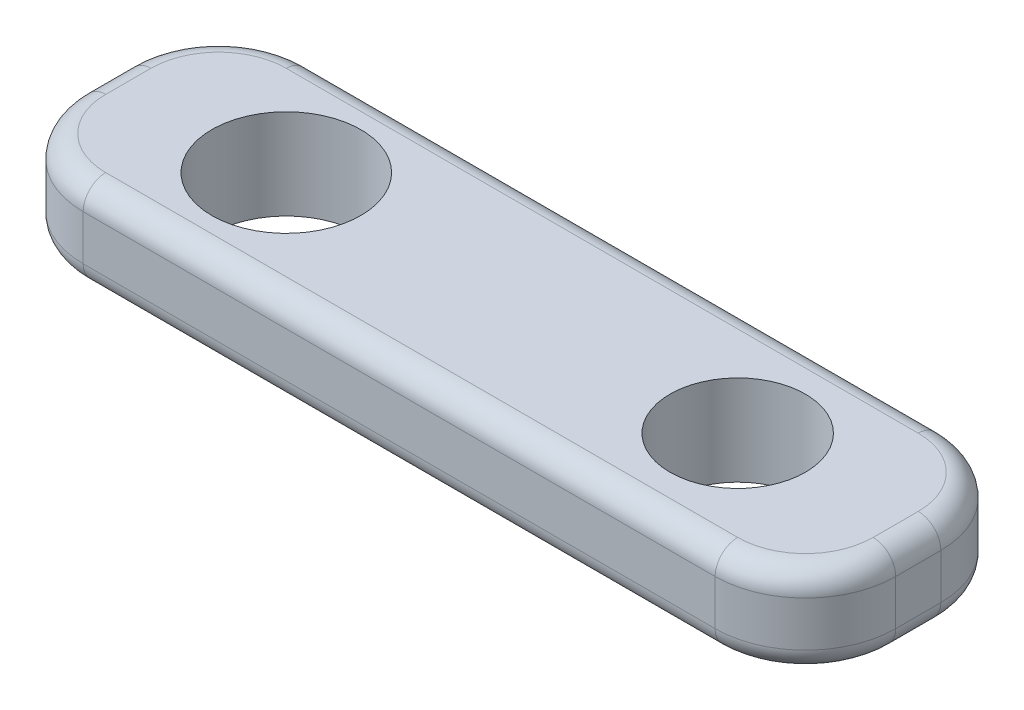
from build123d import *

# Parameters (mm, degrees)
EXTRUDE_1_DEPTH     = 2
SKETCH_3_R          = 1.65
SKETCH_3_R_2        = 1.5
CUT_EXTRUDE_2_DEPTH = 10.552486587
FILLET_1_R          = 0.5


with BuildPart() as part:
    # 草图1 → 凸台-拉伸1 (new body)
    with BuildSketch(Plane(origin=(0, 0, 0), x_dir=(1, 0, 0), z_dir=(0, 1, 0))):
        with BuildLine():
            Line((-7, 2.5), (7, 2.5))
            ThreePointArc((7, 2.5), (8.414213562, 1.914213562), (9, 0.5))
            Line((9, 0.5), (9, -0.5))
            ThreePointArc((9, -0.5), (8.414213562, -1.914213562), (7, -2.5))
            Line((7, -2.5), (-7, -2.5))
            ThreePointArc((-7, -2.5), (-8.414213562, -1.914213562), (-9, -0.5))
            Line((-9, -0.5), (-9, 0.5))
            ThreePointArc((-9, 0.5), (-8.414213562, 1.914213562), (-7, 2.5))
        make_face()
    extrude(amount=EXTRUDE_1_DEPTH)

    # 草图3 → 切除-拉伸2 (cut, through all)
    with BuildSketch(Plane(origin=(0, 2, 0), x_dir=(1, 0, 0), z_dir=(0, 1, 0))):
        with Locations(Location((-5, 0, 0), (0, 0, 270))):
            Circle(SKETCH_3_R)
        with Locations(Location((5, 0, 0), (0, 0, 270))):
            Circle(SKETCH_3_R_2)
    extrude(amount=-CUT_EXTRUDE_2_DEPTH, mode=Mode.SUBTRACT)

    # 圆角1
    fillet_1_edges = [part.edges().sort_by_distance(p)[0] for p in [
        (-9, 0, 0),
        (-8.414213562, 0, -1.914213562),
        (0, 0, -2.5),
        (8.414213562, 0, -1.914213562),
        (-8.414213562, 2, -1.914213562),
        (-9, 2, 0),
        (-8.414213562, 2, 1.914213562),
        (0, 2, 2.5),
        (8.414213562, 2, 1.914213562),
        (9, 2, 0),
        (8.414213562, 2, -1.914213562),
        (9, 0, 0),
        (0, 2, -2.5),
        (8.414213562, 0, 1.914213562),
        (0, 0, 2.5),
        (-8.414213562, 0, 1.914213562),
    ]]
    fillet(fillet_1_edges, radius=FILLET_1_R)


solid = part.part
